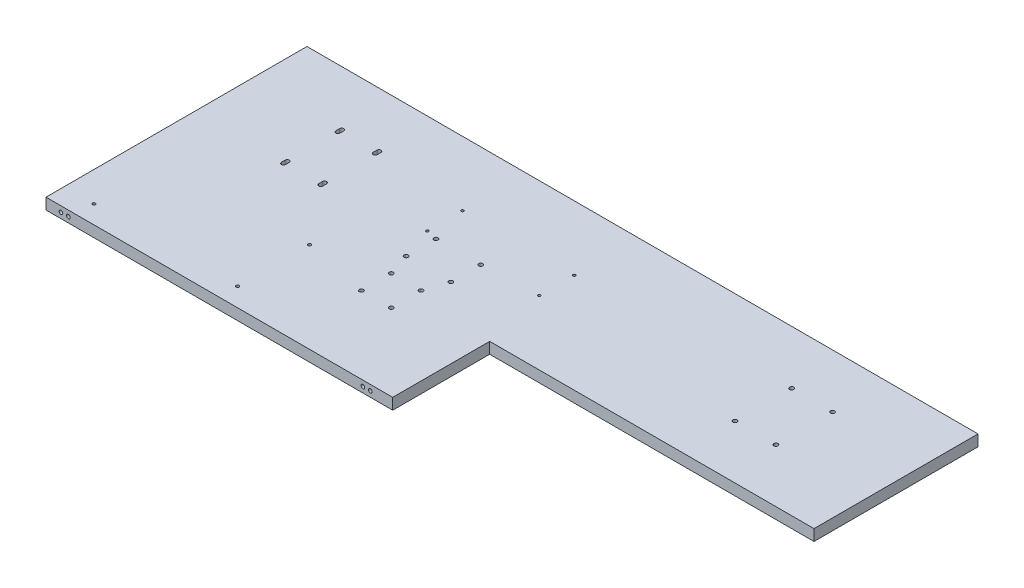
from build123d import *

# Parameters (mm, degrees)
SKETCH1_W           = 900
SKETCH1_H           = 350
BOSS_EXTRUDE1_DEPTH = 15
CUT_EXTRUDE1_REACH  = 485.063
CUT_EXTRUDE2_REACH  = 485.063
SKETCH3_R           = 2
SKETCH10_R          = 2.75
CUT_EXTRUDE6_DEPTH  = 484.063142871
SKETCH11_R          = 1.75
CUT_EXTRUDE7_DEPTH  = 484.063142871
SKETCH12_R          = 2.75
CUT_EXTRUDE8_DEPTH  = 484.063142871
SKETCH13_R          = 2.5
CUT_EXTRUDE9_DEPTH  = 10
SKETCH14_R          = 2.5
CUT_EXTRUDE10_DEPTH = 10
SKETCH15_W          = 434.979135439
SKETCH15_H          = 130.036556738
CUT_EXTRUDE11_DEPTH = 484.063142871


with BuildPart() as part:
    # Sketch1 → Boss-Extrude1 (new body)
    with BuildSketch(Plane(origin=(0, 0, 0), x_dir=(1, 0, 0), z_dir=(0, 1, 0))):
        Rectangle(SKETCH1_W, SKETCH1_H)
    extrude(amount=BOSS_EXTRUDE1_DEPTH)

    # Sketch2 → Cut-Extrude1 (cut, up to next)
    with BuildSketch(Plane(origin=(0, 15, 0), x_dir=(1, 0, 0), z_dir=(0, 1, 0)), mode=Mode.PRIVATE) as cut_extrude1_sk1:
        with BuildLine():
            Line((-282.75, 23.5), (-282.75, 28.5))
            ThreePointArc((-282.75, 28.5), (-280, 31.25), (-277.25, 28.5))
            Line((-277.25, 28.5), (-277.25, 23.5))
            ThreePointArc((-277.25, 23.5), (-280, 20.75), (-282.75, 23.5))
        make_face()
    cut_extrude1_tool1 = extrude(cut_extrude1_sk1.sketch, amount=-CUT_EXTRUDE1_REACH, mode=Mode.PRIVATE) & part.part
    # Sketch2 → Cut-Extrude1 (cut, up to next)
    with BuildSketch(Plane(origin=(0, 15, 0), x_dir=(1, 0, 0), z_dir=(0, 1, 0)), mode=Mode.PRIVATE) as cut_extrude1_sk2:
        with BuildLine():
            Line((-327.25, 101.5), (-327.25, 96.5))
            ThreePointArc((-327.25, 96.5), (-330, 93.75), (-332.75, 96.5))
            Line((-332.75, 96.5), (-332.75, 101.5))
            ThreePointArc((-332.75, 101.5), (-330, 104.25), (-327.25, 101.5))
        make_face()
    cut_extrude1_tool2 = extrude(cut_extrude1_sk2.sketch, amount=-CUT_EXTRUDE1_REACH, mode=Mode.PRIVATE) & part.part
    # Sketch2 → Cut-Extrude1 (cut, up to next)
    with BuildSketch(Plane(origin=(0, 15, 0), x_dir=(1, 0, 0), z_dir=(0, 1, 0)), mode=Mode.PRIVATE) as cut_extrude1_sk3:
        with BuildLine():
            Line((-327.25, 28.5), (-327.25, 23.5))
            ThreePointArc((-327.25, 23.5), (-330, 20.75), (-332.75, 23.5))
            Line((-332.75, 23.5), (-332.75, 28.5))
            ThreePointArc((-332.75, 28.5), (-330, 31.25), (-327.25, 28.5))
        make_face()
    cut_extrude1_tool3 = extrude(cut_extrude1_sk3.sketch, amount=-CUT_EXTRUDE1_REACH, mode=Mode.PRIVATE) & part.part
    # Sketch2 → Cut-Extrude1 (cut, up to next)
    with BuildSketch(Plane(origin=(0, 15, 0), x_dir=(1, 0, 0), z_dir=(0, 1, 0)), mode=Mode.PRIVATE) as cut_extrude1_sk4:
        with BuildLine():
            Line((-282.75, 96.5), (-282.75, 101.5))
            ThreePointArc((-282.75, 101.5), (-280, 104.25), (-277.25, 101.5))
            Line((-277.25, 101.5), (-277.25, 96.5))
            ThreePointArc((-277.25, 96.5), (-280, 93.75), (-282.75, 96.5))
        make_face()
    cut_extrude1_tool4 = extrude(cut_extrude1_sk4.sketch, amount=-CUT_EXTRUDE1_REACH, mode=Mode.PRIVATE) & part.part
    add(cut_extrude1_tool1.solids().sort_by_distance((-280, 15, -26))[0], mode=Mode.SUBTRACT)
    add(cut_extrude1_tool2.solids().sort_by_distance((-330, 15, -99))[0], mode=Mode.SUBTRACT)
    add(cut_extrude1_tool3.solids().sort_by_distance((-330, 15, -26))[0], mode=Mode.SUBTRACT)
    add(cut_extrude1_tool4.solids().sort_by_distance((-280, 15, -99))[0], mode=Mode.SUBTRACT)

    # Sketch3 → Cut-Extrude2 (cut, up to next)
    with BuildSketch(Plane(origin=(0, 15, 0), x_dir=(1, 0, 0), z_dir=(0, 1, 0)), mode=Mode.PRIVATE) as cut_extrude2_sk1:
        with Locations(Location((-218.001464849, -53.5, 0), (0, 0, 270))):
            Circle(SKETCH3_R)
    cut_extrude2_tool1 = extrude(cut_extrude2_sk1.sketch, amount=-CUT_EXTRUDE2_REACH, mode=Mode.PRIVATE) & part.part
    # Sketch3 → Cut-Extrude2 (cut, up to next)
    with BuildSketch(Plane(origin=(0, 15, 0), x_dir=(1, 0, 0), z_dir=(0, 1, 0)), mode=Mode.PRIVATE) as cut_extrude2_sk2:
        with Locations(Location((-218.001464849, -150, 0), (0, 0, 270))):
            Circle(SKETCH3_R)
    cut_extrude2_tool2 = extrude(cut_extrude2_sk2.sketch, amount=-CUT_EXTRUDE2_REACH, mode=Mode.PRIVATE) & part.part
    # Sketch3 → Cut-Extrude2 (cut, up to next)
    with BuildSketch(Plane(origin=(0, 15, 0), x_dir=(1, 0, 0), z_dir=(0, 1, 0)), mode=Mode.PRIVATE) as cut_extrude2_sk3:
        with Locations(Location((-410, -150.75, 0), (0, 0, 270))):
            Circle(SKETCH3_R)
    cut_extrude2_tool3 = extrude(cut_extrude2_sk3.sketch, amount=-CUT_EXTRUDE2_REACH, mode=Mode.PRIVATE) & part.part
    add(cut_extrude2_tool1.solids().sort_by_distance((-218.001465, 15, 53.5))[0], mode=Mode.SUBTRACT)
    add(cut_extrude2_tool2.solids().sort_by_distance((-218.001465, 15, 150))[0], mode=Mode.SUBTRACT)
    add(cut_extrude2_tool3.solids().sort_by_distance((-410, 15, 150.75))[0], mode=Mode.SUBTRACT)

    # Sketch10 → Cut-Extrude6 (cut, through all)
    with BuildSketch(Plane(origin=(0, 15, 0), x_dir=(1, 0, 0), z_dir=(0, 1, 0))):
        with Locations(Location((-140, 38, 0), (0, 0, 270))):
            Circle(SKETCH10_R)
        with Locations(Location((-140, -2, 0), (0, 0, 270))):
            Circle(SKETCH10_R)
        with Locations(Location((-80, -2, 0), (0, 0, 270))):
            Circle(SKETCH10_R)
        with Locations(Location((-80, 38, 0), (0, 0, 270))):
            Circle(SKETCH10_R)
        with Locations(Location((-130, -32, 0), (0, 0, 270))):
            Circle(SKETCH10_R)
        with Locations(Location((-90, -32, 0), (0, 0, 270))):
            Circle(SKETCH10_R)
        with Locations(Location((-130, -72, 0), (0, 0, 270))):
            Circle(SKETCH10_R)
        with Locations(Location((-90, -72, 0), (0, 0, 270))):
            Circle(SKETCH10_R)
    extrude(amount=-CUT_EXTRUDE6_DEPTH, mode=Mode.SUBTRACT)

    # Sketch11 → Cut-Extrude7 (cut, through all)
    with BuildSketch(Plane(origin=(0, 15, 0), x_dir=(1, 0, 0), z_dir=(0, 1, 0))):
        with Locations(Location((-155, 88.5, 0), (0, 0, 270))):
            Circle(SKETCH11_R)
        with Locations(Location((-155, 41.5, 0), (0, 0, 270))):
            Circle(SKETCH11_R)
        with Locations(Location((-5, 88.5, 0), (0, 0, 270))):
            Circle(SKETCH11_R)
        with Locations(Location((-5, 41.5, 0), (0, 0, 270))):
            Circle(SKETCH11_R)
    extrude(amount=-CUT_EXTRUDE7_DEPTH, mode=Mode.SUBTRACT)

    # Sketch12 → Cut-Extrude8 (cut, through all)
    with BuildSketch(Plane(origin=(0, 15, 0), x_dir=(1, 0, 0), z_dir=(0, 1, 0))):
        with Locations(Location((272, 103, 0), (0, 0, 270))):
            Circle(SKETCH12_R)
        with Locations(Location((327, 103, 0), (0, 0, 270))):
            Circle(SKETCH12_R)
        with Locations(Location((272, 27, 0), (0, 0, 270))):
            Circle(SKETCH12_R)
        with Locations(Location((327, 27, 0), (0, 0, 270))):
            Circle(SKETCH12_R)
    extrude(amount=-CUT_EXTRUDE8_DEPTH, mode=Mode.SUBTRACT)

    # Sketch13 → Cut-Extrude9 (cut)
    with BuildSketch(Plane(origin=(0, 0, -175), x_dir=(-1, 0, 0), z_dir=(0, 0, -1))):
        with Locations((15, 7.5)):
            Circle(SKETCH13_R)
        with Locations((25, 7.5)):
            Circle(SKETCH13_R)
        with Locations((430, 7.5)):
            Circle(SKETCH13_R)
        with Locations((420, 7.5)):
            Circle(SKETCH13_R)
    cut_extrude9 = extrude(amount=-CUT_EXTRUDE9_DEPTH, mode=Mode.SUBTRACT)

    # Mirror1: Cut-Extrude9 across plane
    add(cut_extrude9.mirror(Plane.XY), mode=Mode.SUBTRACT)

    # Sketch14 → Cut-Extrude10 (cut)
    with BuildSketch(Plane.ZY.offset(450)):
        with Locations((-145, 7.5)):
            Circle(SKETCH14_R)
        with Locations((-135, 7.5)):
            Circle(SKETCH14_R)
        with Locations((145, 7.5)):
            Circle(SKETCH14_R)
        with Locations((135, 7.5)):
            Circle(SKETCH14_R)
    extrude(amount=-CUT_EXTRUDE10_DEPTH, mode=Mode.SUBTRACT)

    # Sketch15 → Cut-Extrude11 (cut, through all)
    with BuildSketch(Plane(origin=(0, 15, 0), x_dir=(1, 0, 0), z_dir=(0, 1, 0))):
        with Locations((232.51043228, -109.981721631)):
            Rectangle(SKETCH15_W, SKETCH15_H)
    extrude(amount=-CUT_EXTRUDE11_DEPTH, mode=Mode.SUBTRACT)


solid = part.part
